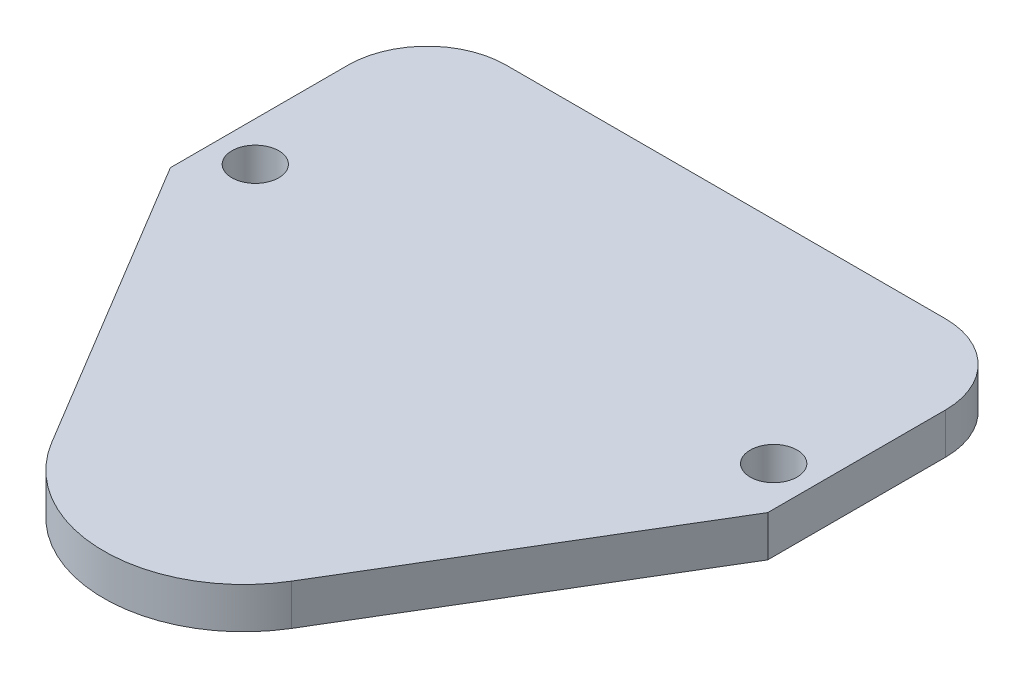
from build123d import *

# Parameters (mm, degrees)
SKETCH1_R           = 2.375
BOSS_EXTRUDE1_DEPTH = 4.15


with BuildPart() as part:
    # Sketch1 → Boss-Extrude1 (new body)
    with BuildSketch(Plane(origin=(0, 0, 0), x_dir=(1, 0, 0), z_dir=(0, 1, 0))):
        with BuildLine():
            Line((-22.25, 31.5), (22.25, 31.5))
            ThreePointArc((22.25, 31.5), (27.906854249, 29.156854249), (30.25, 23.5))
            Line((30.25, 23.5), (30.25, 5.5))
            Line((30.25, 5.5), (12.147813291, -24.627097925))
            ThreePointArc((12.147813291, -24.627097925), (0, -31.5), (-12.147813291, -24.627097925))
            Line((-12.147813291, -24.627097925), (-30.25, 5.5))
            Line((-30.25, 5.5), (-30.25, 23.5))
            ThreePointArc((-30.25, 23.5), (-27.906854249, 29.156854249), (-22.25, 31.5))
        make_face()
        with Locations(Location((26.25, 10.1, 0), (0, 0, 90))):
            Circle(SKETCH1_R, mode=Mode.SUBTRACT)
        with Locations(Location((-26.25, 10.1, 0), (0, 0, 90))):
            Circle(SKETCH1_R, mode=Mode.SUBTRACT)
    extrude(amount=BOSS_EXTRUDE1_DEPTH)


solid = part.part
